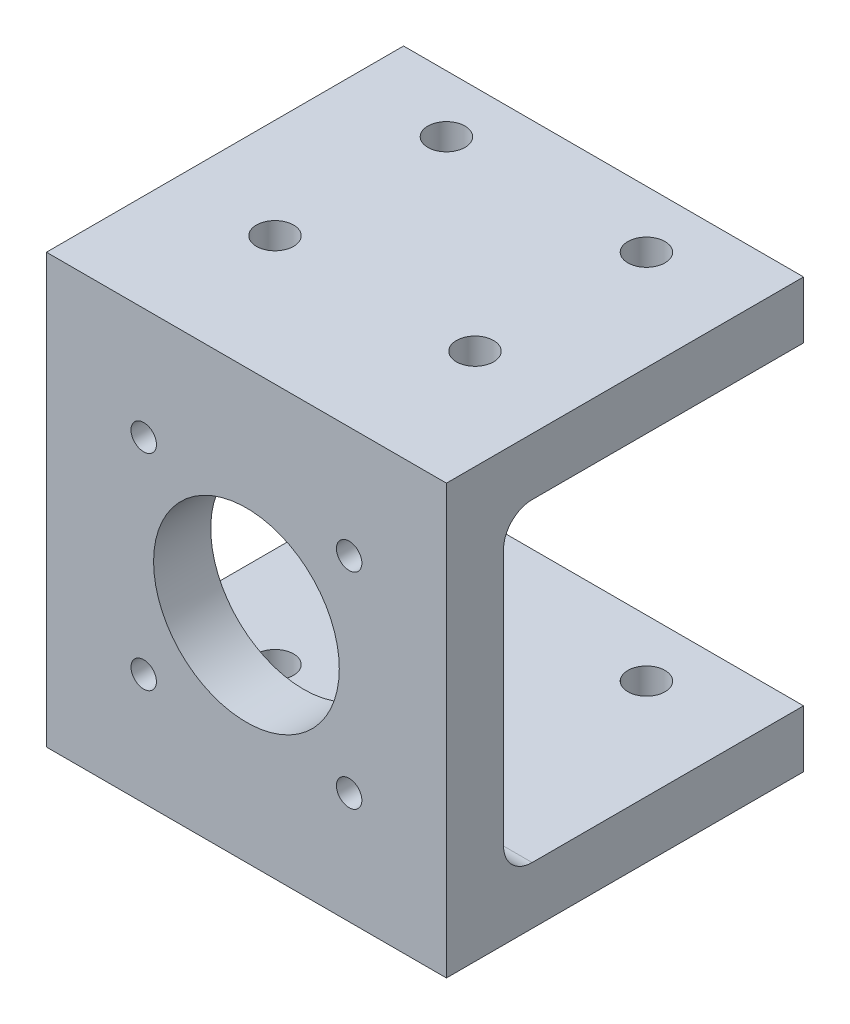
from build123d import *

# Parameters (mm, degrees)
SKETCH1_W                                    = 35.56
SKETCH1_H                                    = 38.1
SKETCH1_R                                    = 8.255
SKETCH1_R_2                                  = 1.1303
BOSS_EXTRUDE_WITH_4_40_TAP_DRILL_HOLES_DEPTH = 15.875
CUT_EXTRUDE1_REACH                           = 45.352
SKETCH3_W                                    = 26.67
SKETCH3_H                                    = 27.94
FILLET1_R                                    = 2.54
SKETCH5_R                                    = 1.65
CLEARANCE_HOLES_FOR_M3_SCREW_DEPTH           = 45.941673589


with BuildPart() as part:
    # Sketch1 → Boss-Extrude with 4-40 Tap Drill Holes (new, symmetric)
    with BuildSketch(Plane.XY):
        Rectangle(SKETCH1_W, SKETCH1_H)
        Circle(SKETCH1_R, mode=Mode.SUBTRACT)
        with Locations((-9.1313, 9.1313)):
            Circle(SKETCH1_R_2, mode=Mode.SUBTRACT)
        with Locations((9.1313, 9.1313)):
            Circle(SKETCH1_R_2, mode=Mode.SUBTRACT)
        with Locations((-9.1313, -9.1313)):
            Circle(SKETCH1_R_2, mode=Mode.SUBTRACT)
        with Locations((9.1313, -9.1313)):
            Circle(SKETCH1_R_2, mode=Mode.SUBTRACT)
    extrude(amount=BOSS_EXTRUDE_WITH_4_40_TAP_DRILL_HOLES_DEPTH, both=True)

    # Sketch3 → Cut-Extrude1 (cut, up to next)
    with BuildSketch(Plane(origin=(17.78, 0, 0), x_dir=(0, 0, -1), z_dir=(1, 0, 0)), mode=Mode.PRIVATE) as cut_extrude1_sk1:
        with Locations((2.54, 0)):
            Rectangle(SKETCH3_W, SKETCH3_H)
    cut_extrude1_tool1 = extrude(cut_extrude1_sk1.sketch, amount=-CUT_EXTRUDE1_REACH, mode=Mode.PRIVATE) & part.part
    add(cut_extrude1_tool1.solids().sort_by_distance((17.78, 0, -2.54))[0], mode=Mode.SUBTRACT)

    # Fillet1
    fillet1_edges = [part.edges().sort_by_distance(p)[0] for p in [
        (0, -13.97, 10.795),
        (0, 13.97, 10.795),
    ]]
    fillet(fillet1_edges, radius=FILLET1_R)

    # Sketch5 → Clearance Holes for M3 Screw (cut, through all)
    with BuildSketch(Plane(origin=(0, 19.05, 0), x_dir=(1, 0, 0), z_dir=(0, 1, 0))):
        with Locations(Location((-8.89, 10.795, 0), (0, 0, 270))):
            Circle(SKETCH5_R)
        with Locations(Location((-8.89, -4.445, 0), (0, 0, 270))):
            Circle(SKETCH5_R)
        with Locations(Location((8.89, -4.445, 0), (0, 0, 270))):
            Circle(SKETCH5_R)
        with Locations(Location((8.89, 10.795, 0), (0, 0, 270))):
            Circle(SKETCH5_R)
    extrude(amount=-CLEARANCE_HOLES_FOR_M3_SCREW_DEPTH, mode=Mode.SUBTRACT)


solid = part.part
